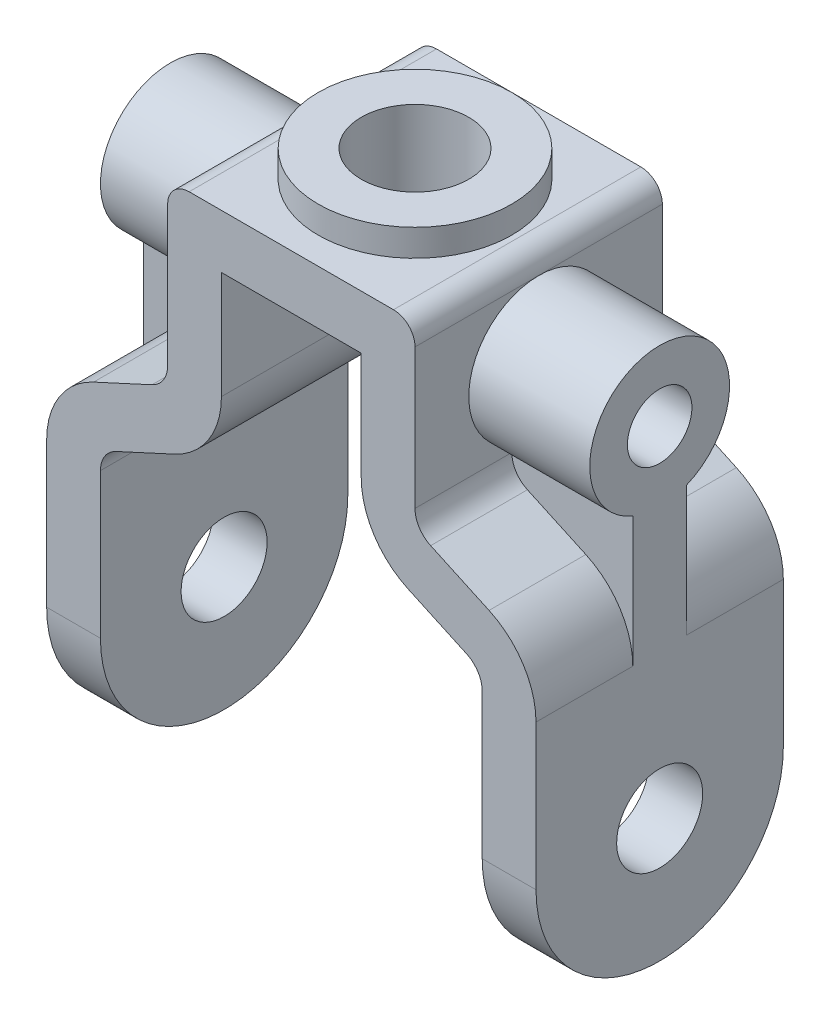
from build123d import *

# Parameters (mm, degrees)
BOSS_EXTRUDE1_DEPTH = 23
SKETCH2_R           = 8
CUT_EXTRUDE1_DEPTH  = 133.250640603
SKETCH3_R           = 18
SKETCH3_R_2         = 10
BOSS_EXTRUDE2_DEPTH = 5
CUT_EXTRUDE2_REACH  = 117.078
SKETCH4_R           = 10
BOSS_EXTRUDE3_REACH = 134.251
SKETCH5_R           = 6
CUT_EXTRUDE4_REACH  = 119.905
SKETCH7_R           = 6


with BuildPart() as part:
    # Sketch1 → Boss-Extrude1 (new, symmetric)
    with BuildSketch(Plane.XY):
        with BuildLine():
            Line((0, 0), (13, 0))
            Line((13, 0), (13, -20))
            ThreePointArc((13, -20), (15.369109272, -28.090772486), (21.728079924, -33.625821757))
            Line((21.728079924, -33.625821757), (32.590640025, -38.625821757))
            ThreePointArc((32.590640025, -38.625821757), (34.710296909, -40.470838181), (35.5, -43.167762343))
            Line((35.5, -43.167762343), (35.5, -93.167762343))
            Line((35.5, -93.167762343), (45.5, -93.167762343))
            Line((45.5, -93.167762343), (45.5, -43.167762343))
            ThreePointArc((45.5, -43.167762343), (43.130890728, -35.076989856), (36.771920076, -29.541940586))
            Line((36.771920076, -29.541940586), (25.909359975, -24.541940586))
            ThreePointArc((25.909359975, -24.541940586), (23.789703091, -22.696924162), (23, -20))
            Line((23, -20), (23, 6))
            ThreePointArc((23, 6), (21.828427125, 8.828427125), (19, 10))
            Line((19, 10), (-19, 10))
            ThreePointArc((-19, 10), (-21.828427125, 8.828427125), (-23, 6))
            Line((-23, 6), (-23, -20))
            ThreePointArc((-23, -20), (-23.789703091, -22.696924162), (-25.909359975, -24.541940586))
            Line((-25.909359975, -24.541940586), (-36.771920076, -29.541940586))
            ThreePointArc((-36.771920076, -29.541940586), (-43.130890728, -35.076989856), (-45.5, -43.167762343))
            Line((-45.5, -43.167762343), (-45.5, -93.167762343))
            Line((-45.5, -93.167762343), (-35.5, -93.167762343))
            Line((-35.5, -93.167762343), (-35.5, -43.167762343))
            ThreePointArc((-35.5, -43.167762343), (-34.710296909, -40.470838181), (-32.590640025, -38.625821757))
            Line((-32.590640025, -38.625821757), (-21.728079924, -33.625821757))
            ThreePointArc((-21.728079924, -33.625821757), (-15.369109272, -28.090772486), (-13, -20))
            Line((-13, -20), (-13, 0))
            Line((-13, 0), (0, 0))
        make_face()
    extrude(amount=BOSS_EXTRUDE1_DEPTH, both=True)

    # Sketch2 → Cut-Extrude1 (cut, through all)
    with BuildSketch(Plane(origin=(45.5, 0, 0), x_dir=(0, 0, -1), z_dir=(1, 0, 0))):
        with Locations(Location((0, -70.167762343, 0), (0, 0, 90))):
            Circle(SKETCH2_R)
        with BuildLine():
            ThreePointArc((0, -93.167762343), (-16.263455967, -86.43121831), (-23, -70.167762343))
            Line((-23, -70.167762343), (-23, -93.167762343))
            Line((-23, -93.167762343), (0, -93.167762343))
        make_face()
        with BuildLine():
            ThreePointArc((23, -70.167762343), (16.263455967, -86.43121831), (0, -93.167762343))
            Line((0, -93.167762343), (23, -93.167762343))
            Line((23, -93.167762343), (23, -70.167762343))
        make_face()
    extrude(amount=-CUT_EXTRUDE1_DEPTH, mode=Mode.SUBTRACT)

    # Sketch3 → Boss-Extrude2 (add)
    with BuildSketch(Plane(origin=(0, 10, 0), x_dir=(1, 0, 0), z_dir=(0, 1, 0))):
        with Locations(Location((0, 0, 0), (0, 0, 90))):
            Circle(SKETCH3_R)
        with Locations(Location((0, 0, 0), (0, 0, 270))):
            Circle(SKETCH3_R_2, mode=Mode.SUBTRACT)
    extrude(amount=BOSS_EXTRUDE2_DEPTH)

    # Sketch4 → Cut-Extrude2 (cut, up to next)
    with BuildSketch(Plane(origin=(0, 10, 0), x_dir=(1, 0, 0), z_dir=(0, 1, 0)), mode=Mode.PRIVATE) as cut_extrude2_sk1:
        with Locations(Location((0, 0, 0), (0, 0, 270))):
            Circle(SKETCH4_R)
    cut_extrude2_tool1 = extrude(cut_extrude2_sk1.sketch, amount=-CUT_EXTRUDE2_REACH, mode=Mode.PRIVATE) & part.part
    add(cut_extrude2_tool1.solids().sort_by_distance((0, 10, 0))[0], mode=Mode.SUBTRACT)

    # Sketch5 → Boss-Extrude3 (add, up to next)
    with BuildSketch(Plane(origin=(45.5, 0, 0), x_dir=(0, 0, -1), z_dir=(1, 0, 0)), mode=Mode.PRIVATE) as boss_extrude3_sk1:
        with BuildLine():
            Line((5, -60.379262018), (5, -19))
            ThreePointArc((5, -19), (0, 6), (-5, -19))
            Line((-5, -19), (-5, -60.379262018))
            Line((-5, -60.379262018), (5, -60.379262018))
        make_face()
        with Locations(Location((0, -7, 0), (0, 0, 90))):
            Circle(SKETCH5_R, mode=Mode.SUBTRACT)
    boss_extrude3_tool1 = extrude(boss_extrude3_sk1.sketch, amount=-BOSS_EXTRUDE3_REACH, mode=Mode.PRIVATE) - part.part
    boss_extrude3 = boss_extrude3_tool1.solids().sort_by_distance((45.5, -23.296906, 0))[0]
    add(boss_extrude3)

    # Sketch7 → Cut-Extrude4 (cut, up to next)
    with BuildSketch(Plane(origin=(23, 0, 0), x_dir=(0, 0, -1), z_dir=(1, 0, 0)), mode=Mode.PRIVATE) as cut_extrude4_sk1:
        with Locations(Location((0, -7, 0), (0, 0, 90))):
            Circle(SKETCH7_R)
    cut_extrude4_tool1 = extrude(cut_extrude4_sk1.sketch, amount=-CUT_EXTRUDE4_REACH, mode=Mode.PRIVATE) & part.part
    cut_extrude4 = cut_extrude4_tool1.solids().sort_by_distance((23, -7, 0))[0]
    add(cut_extrude4, mode=Mode.SUBTRACT)

    # Mirror1: Boss-Extrude3, Cut-Extrude4 across plane
    add(boss_extrude3.mirror(Plane(origin=(0, 0, 0), x_dir=(0, 0, 1), z_dir=(1, 0, 0))))
    add(cut_extrude4.mirror(Plane(origin=(0, 0, 0), x_dir=(0, 0, 1), z_dir=(1, 0, 0))), mode=Mode.SUBTRACT)


solid = part.part
